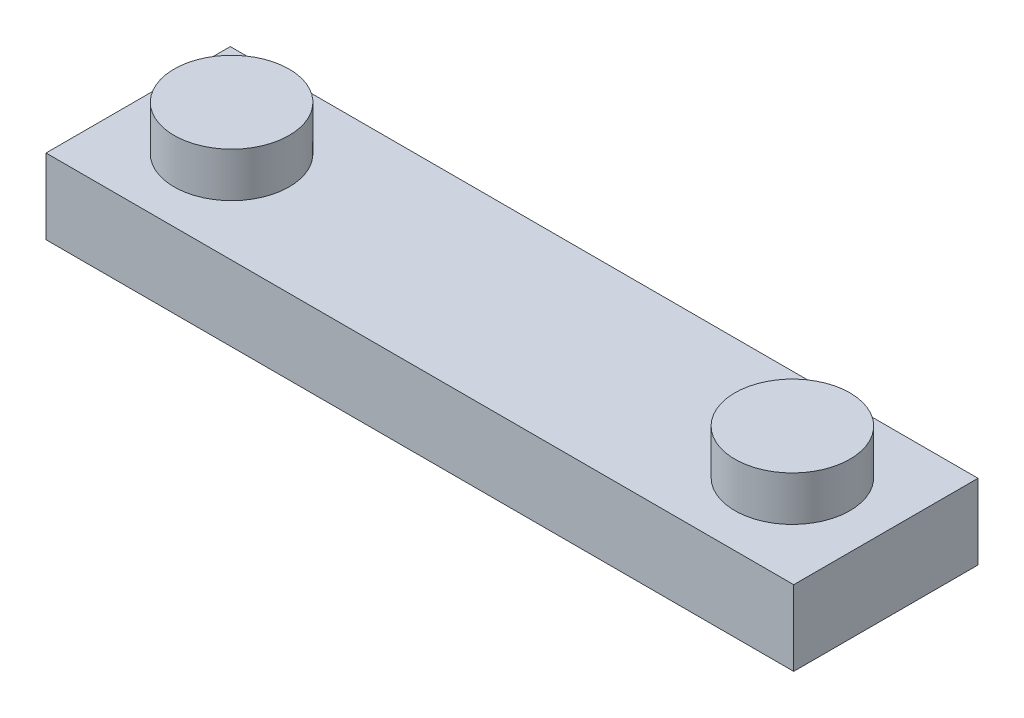
from build123d import *

# Parameters (mm, degrees)
SKETCH1_W           = 31.85
SKETCH1_H           = 7.85
BOSS_EXTRUDE1_DEPTH = 3.2
SKETCH2_R           = 2.45
BOSS_EXTRUDE2_DEPTH = 1.9
SHELL1_T            = -1.5
SKETCH3_R           = 1.5
SKETCH3_R_2         = 0.53
BOSS_EXTRUDE3_DEPTH = 1.5


with BuildPart() as part:
    # Sketch1 → Boss-Extrude1 (new body)
    with BuildSketch(Plane(origin=(0, 0, 0), x_dir=(1, 0, 0), z_dir=(0, 1, 0))):
        Rectangle(SKETCH1_W, SKETCH1_H)
    extrude(amount=-BOSS_EXTRUDE1_DEPTH)

    # Sketch2 → Boss-Extrude2 (add)
    with BuildSketch(Plane(origin=(0, 0, 0), x_dir=(1, 0, 0), z_dir=(0, 1, 0))):
        with Locations(Location((11.94375, 0, 0), (0, 0, 90))):
            Circle(SKETCH2_R)
        with Locations(Location((-11.94375, 0, 0), (0, 0, 90))):
            Circle(SKETCH2_R)
    extrude(amount=BOSS_EXTRUDE2_DEPTH)

    # Shell1
    shell1_openings = [part.faces().sort_by_distance(p)[0] for p in [
        (0, -3.2, 0),
    ]]
    offset(amount=SHELL1_T, openings=shell1_openings, kind=Kind.INTERSECTION)

    # Sketch3 → Boss-Extrude3 (add)
    # profile 1 of 3: a face of its own
    with BuildSketch(Plane.XZ.offset(1.5)):
        with Locations(Location((-7.9625, 0, 0), (0, 0, 90))):
            Circle(SKETCH3_R)
        with Locations(Location((-7.9625, 0, 0), (0, 0, 90))):
            Circle(SKETCH3_R_2, mode=Mode.SUBTRACT)
    # profile 2 of 3: a face of its own
    with BuildSketch(Plane.XZ.offset(1.5)):
        with Locations(Location((0, 0, 0), (0, 0, 90))):
            Circle(SKETCH3_R)
        with Locations(Location((0, 0, 0), (0, 0, 90))):
            Circle(SKETCH3_R_2, mode=Mode.SUBTRACT)
    # profile 3 of 3: a face of its own
    with BuildSketch(Plane.XZ.offset(1.5)):
        with Locations(Location((7.9625, 0, 0), (0, 0, 90))):
            Circle(SKETCH3_R)
        with Locations(Location((7.9625, 0, 0), (0, 0, 90))):
            Circle(SKETCH3_R_2, mode=Mode.SUBTRACT)
    extrude(amount=BOSS_EXTRUDE3_DEPTH)


solid = part.part
